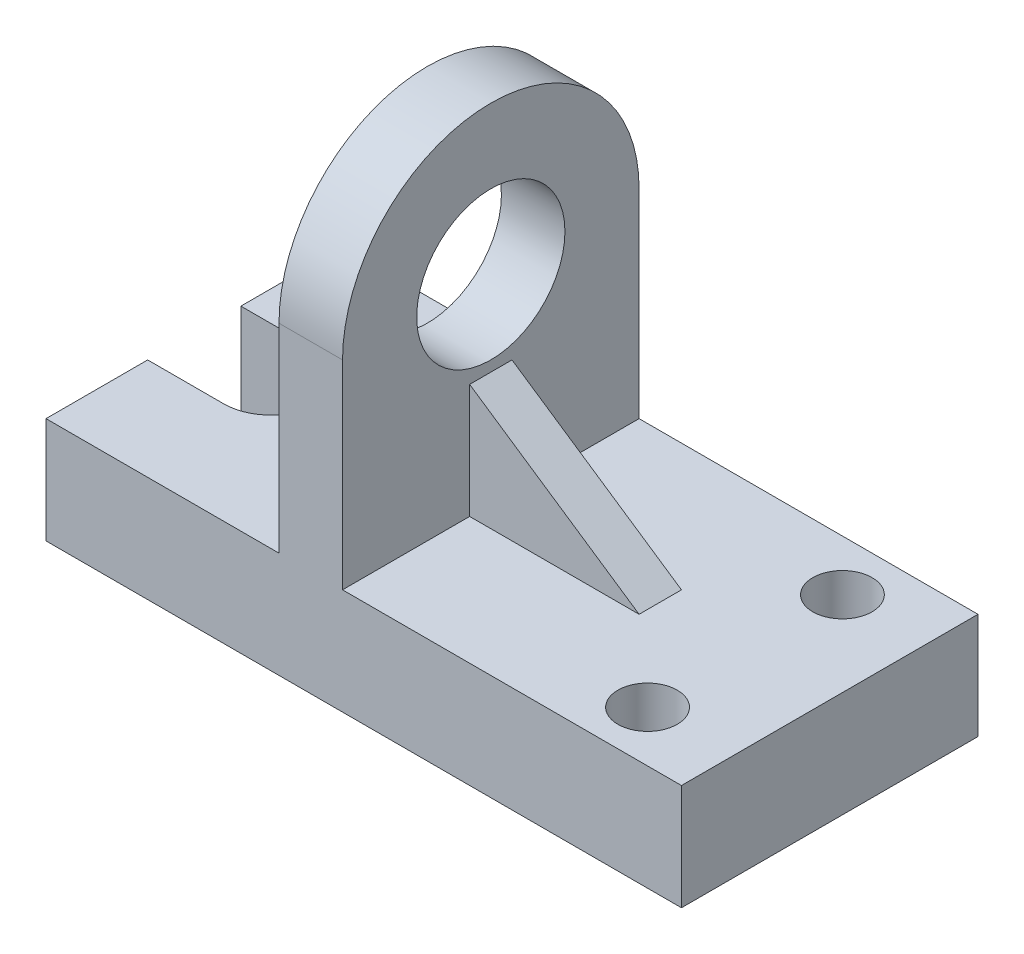
from build123d import *

# Parameters (mm, degrees)
SKETCH_1_W           = 150
SKETCH_1_H           = 25
EXTRUDE_1_DEPTH      = 70
SKETCH_2_R           = 7
CUT_EXTRUDE_1_DEPTH  = 168.406690428
EXTRUDE_START        = -80
SKETCH_3_R           = 17.5
EXTRUDE_2_DEPTH      = 15
EXTRUDE_5_DEPTH      = 5
EXTRUDE_5_DEPTH_BACK = 5


with BuildPart() as part:
    # Эскиз1 → Бобышка-Вытянуть1 (new body)
    with BuildSketch(Plane.XY):
        with Locations((75, -12.5)):
            Rectangle(SKETCH_1_W, SKETCH_1_H)
    extrude(amount=EXTRUDE_1_DEPTH)

    # Эскиз2 → Вырез-Вытянуть1 (cut, through all)
    with BuildSketch(Plane(origin=(0, 0, 0), x_dir=(1, 0, 0), z_dir=(0, 1, 0))):
        with BuildLine():
            Line((18, -24), (0, -24))
            Line((0, -24), (0, -46))
            Line((0, -46), (18, -46))
            ThreePointArc((18, -46), (29, -35), (18, -24))
        make_face()
        with Locations(Location((130, -12, 0), (0, 0, 270))):
            Circle(SKETCH_2_R)
        with Locations(Location((130, -58, 0), (0, 0, 270))):
            Circle(SKETCH_2_R)
    extrude(amount=-CUT_EXTRUDE_1_DEPTH, mode=Mode.SUBTRACT)

    # Эскиз3 → Бобышка-Вытянуть2 (add)
    with BuildSketch(Plane(origin=(150, 0, 0), x_dir=(0, 0, -1), z_dir=(1, 0, 0)).offset(EXTRUDE_START)):
        with BuildLine():
            Line((-70, 0), (-70, 47))
            ThreePointArc((-70, 47), (-35, 82), (0, 47))
            Line((0, 47), (0, 0))
            Line((0, 0), (-70, 0))
        make_face()
        with Locations((-35, 47)):
            Circle(SKETCH_3_R, mode=Mode.SUBTRACT)
    extrude(amount=-EXTRUDE_2_DEPTH)

    # Sketch 1 2 → Бобышка-Вытянуть5 (add, two sides: drawn at the far end of the back side and taken through both)
    with BuildSketch(Plane(origin=(70, 27, 35), x_dir=(0.8288486740756482, -0.5594728550010625, 0), z_dir=(0, 0, -1)).offset(-EXTRUDE_5_DEPTH_BACK)):
        Polygon((0, 0), (48.259714048, 0), (15.105767085, 22.3789142), align=None)
    extrude(amount=EXTRUDE_5_DEPTH + EXTRUDE_5_DEPTH_BACK)


solid = part.part
